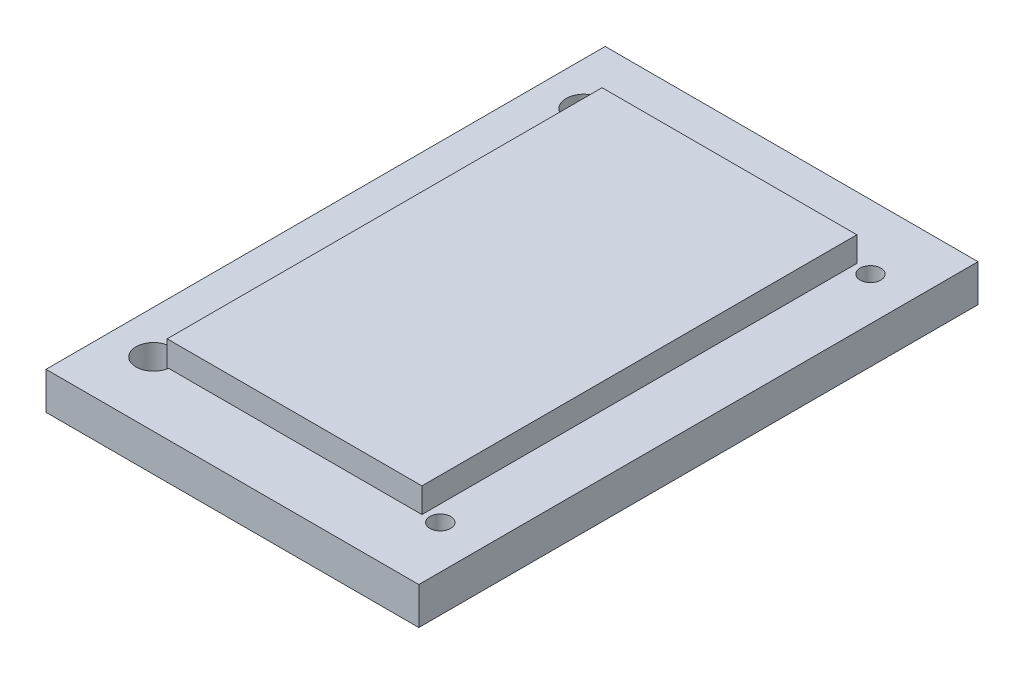
from build123d import *

# Parameters (mm, degrees)
F_01_BASE_PROFILE_W           = 120
F_01_BASE_PROFILE_H           = 180
F_01_BASE_PROFILE_R           = 5.653846154
F_01_BASE_PROFILE_R_2         = 3.346153846
F_01_BASE_PROFILE_W_2         = 18
F_01_BASE_PROFILE_H_2         = 125
F_01_BASE_EXTRUDE_DEPTH       = 12
F_02_BOSS_PROFILE_W           = 82
F_02_BOSS_PROFILE_H           = 140
F_02_REINFORCEMENT_BOSS_DEPTH = 20


with BuildPart() as part:
    # 01_Base_Profile → 01_Base_Extrude (new body)
    with BuildSketch(Plane(origin=(0, 0, 0), x_dir=(1, 0, 0), z_dir=(0, 1, 0))):
        Rectangle(F_01_BASE_PROFILE_W, F_01_BASE_PROFILE_H)
        with Locations(Location((-46.153846154, -69.230769231, 0), (0, 0, 270))):
            Circle(F_01_BASE_PROFILE_R, mode=Mode.SUBTRACT)
        with Locations(Location((46.153846154, -69.230769231, 0), (0, 0, 270))):
            Circle(F_01_BASE_PROFILE_R_2, mode=Mode.SUBTRACT)
        with Locations(Location((-46.153846154, 69.230769231, 0), (0, 0, 270))):
            Circle(F_01_BASE_PROFILE_R, mode=Mode.SUBTRACT)
        with Locations(Location((46.153846154, 69.230769231, 0), (0, 0, 270))):
            Circle(F_01_BASE_PROFILE_R_2, mode=Mode.SUBTRACT)
        Rectangle(F_01_BASE_PROFILE_W_2, F_01_BASE_PROFILE_H_2, mode=Mode.SUBTRACT)
    extrude(amount=F_01_BASE_EXTRUDE_DEPTH)

    # 02_Boss_Profile → 02_Reinforcement_Boss (add)
    with BuildSketch(Plane(origin=(0, 0, 0), x_dir=(1, 0, 0), z_dir=(0, 1, 0))):
        Rectangle(F_02_BOSS_PROFILE_W, F_02_BOSS_PROFILE_H)
    extrude(amount=F_02_REINFORCEMENT_BOSS_DEPTH)


solid = part.part
